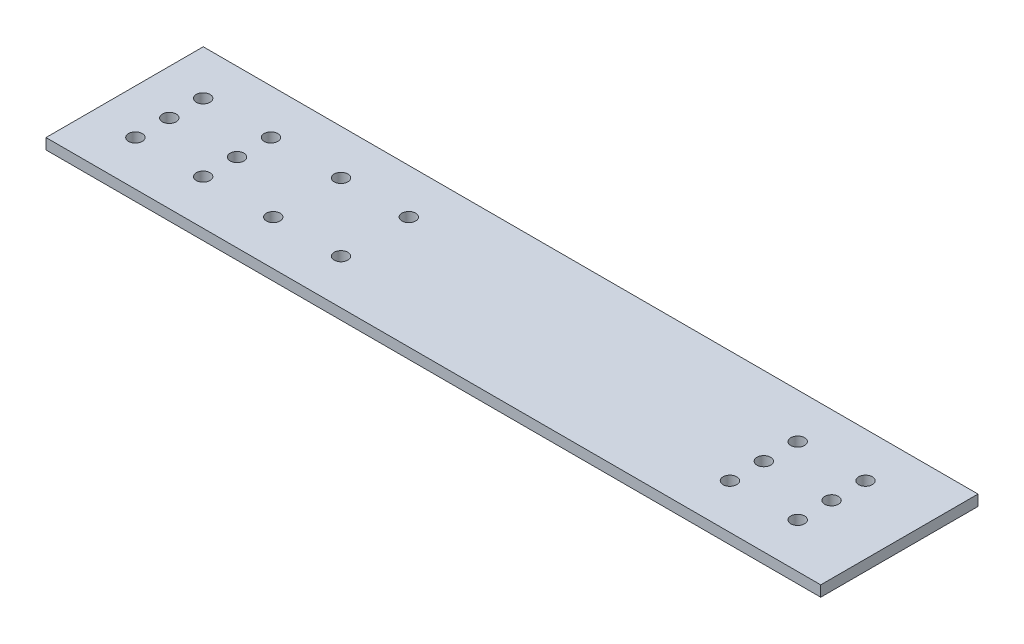
from build123d import *

# Parameters (mm, degrees)
SKETCH1_W           = 457.2
SKETCH1_H           = 92.8
SKETCH1_R           = 4.05
BOSS_EXTRUDE1_DEPTH = 6.35


with BuildPart() as part:
    # Sketch1 → Boss-Extrude1 (new body)
    with BuildSketch(Plane(origin=(0, 0, 0), x_dir=(1, 0, 0), z_dir=(0, 1, 0))):
        with Locations((182.25, 0)):
            Rectangle(SKETCH1_W, SKETCH1_H)
        with Locations(Location((-20, 20, 0), (0, 0, 270))):
            Circle(SKETCH1_R, mode=Mode.SUBTRACT)
        with Locations(Location((20, 20, 0), (0, 0, 270))):
            Circle(SKETCH1_R, mode=Mode.SUBTRACT)
        with Locations(Location((20, -20, 0), (0, 0, 270))):
            Circle(SKETCH1_R, mode=Mode.SUBTRACT)
        with Locations(Location((-20, -20, 0), (0, 0, 270))):
            Circle(SKETCH1_R, mode=Mode.SUBTRACT)
        with Locations(Location((-20, 0, 0), (0, 0, 270))):
            Circle(SKETCH1_R, mode=Mode.SUBTRACT)
        with Locations(Location((20, 0, 0), (0, 0, 270))):
            Circle(SKETCH1_R, mode=Mode.SUBTRACT)
        with Locations(Location((330.85, 20, 0), (0, 0, 270))):
            Circle(SKETCH1_R, mode=Mode.SUBTRACT)
        with Locations(Location((370.85, 20, 0), (0, 0, 270))):
            Circle(SKETCH1_R, mode=Mode.SUBTRACT)
        with Locations(Location((370.85, -20, 0), (0, 0, 270))):
            Circle(SKETCH1_R, mode=Mode.SUBTRACT)
        with Locations(Location((330.85, -20, 0), (0, 0, 270))):
            Circle(SKETCH1_R, mode=Mode.SUBTRACT)
        with Locations(Location((330.85, 0, 0), (0, 0, 270))):
            Circle(SKETCH1_R, mode=Mode.SUBTRACT)
        with Locations(Location((370.85, 0, 0), (0, 0, 270))):
            Circle(SKETCH1_R, mode=Mode.SUBTRACT)
        with Locations(Location((61.35, 20, 0), (0, 0, 270))):
            Circle(SKETCH1_R, mode=Mode.SUBTRACT)
        with Locations(Location((101.35, 20, 0), (0, 0, 270))):
            Circle(SKETCH1_R, mode=Mode.SUBTRACT)
        with Locations(Location((101.35, -20, 0), (0, 0, 270))):
            Circle(SKETCH1_R, mode=Mode.SUBTRACT)
        with Locations(Location((61.35, -20, 0), (0, 0, 270))):
            Circle(SKETCH1_R, mode=Mode.SUBTRACT)
    extrude(amount=BOSS_EXTRUDE1_DEPTH)


solid = part.part
